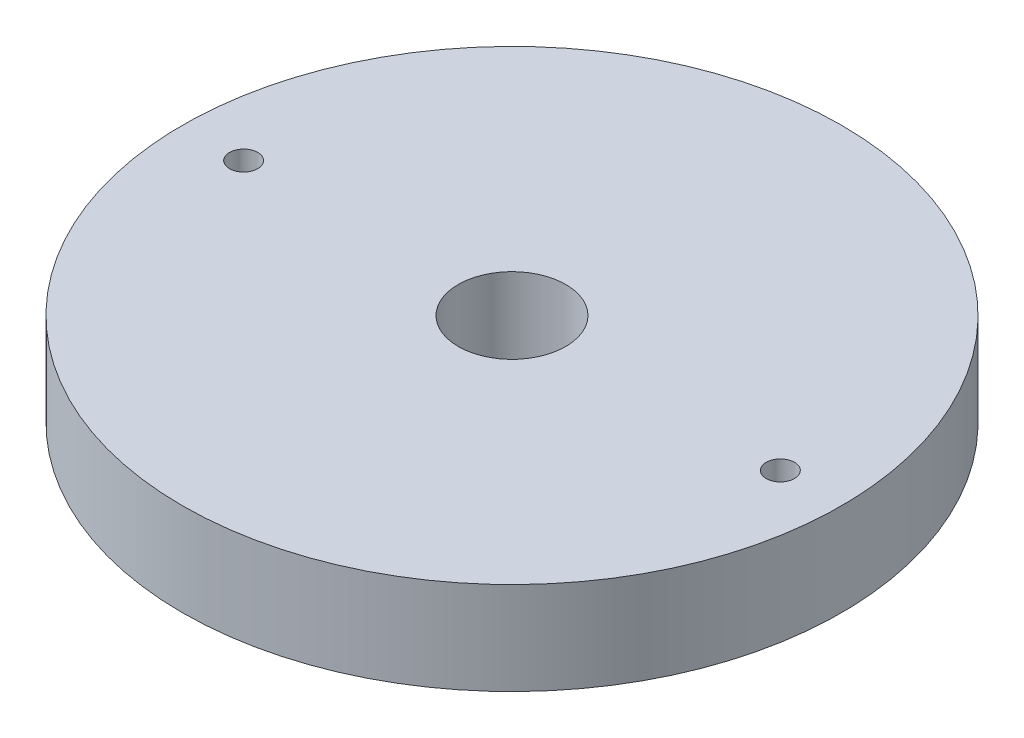
from build123d import *

# Parameters (mm, degrees)
SKETCH1_R            = 17.78
SKETCH1_R_2          = 0.762
BOSS_EXTRUDE1_DEPTH  = 5
SKETCH5_R            = 2.667
CUT_EXTRUDE1_DEPTH   = 3
M5_CLEARANCE_HOLE2_D = 5.8


with BuildPart() as part:
    # Sketch1 → Boss-Extrude1 (new body)
    with BuildSketch(Plane(origin=(0, 0, 0), x_dir=(1, 0, 0), z_dir=(0, 1, 0))):
        with Locations(Location((0, 0, 0), (0, 0, 270))):
            Circle(SKETCH1_R)
        with Locations(Location((-14.478, 0, 0), (0, 0, 270))):
            Circle(SKETCH1_R_2, mode=Mode.SUBTRACT)
        with Locations(Location((14.478, 0, 0), (0, 0, 270))):
            Circle(SKETCH1_R_2, mode=Mode.SUBTRACT)
    extrude(amount=BOSS_EXTRUDE1_DEPTH)

    # Sketch5 → Cut-Extrude1 (cut)
    with BuildSketch(Plane.XZ):
        with Locations(Location((0, 13.97, 0), (0, 0, 270))):
            Circle(SKETCH5_R)
    extrude(amount=-CUT_EXTRUDE1_DEPTH, mode=Mode.SUBTRACT)

    # M5 Clearance Hole2 (through all)
    with Locations(Plane(origin=(0, 5, 0), x_dir=(1, 0, 0), z_dir=(0, 1, 0))):
        with Locations((0, 0)):
            Hole(M5_CLEARANCE_HOLE2_D / 2)


solid = part.part
